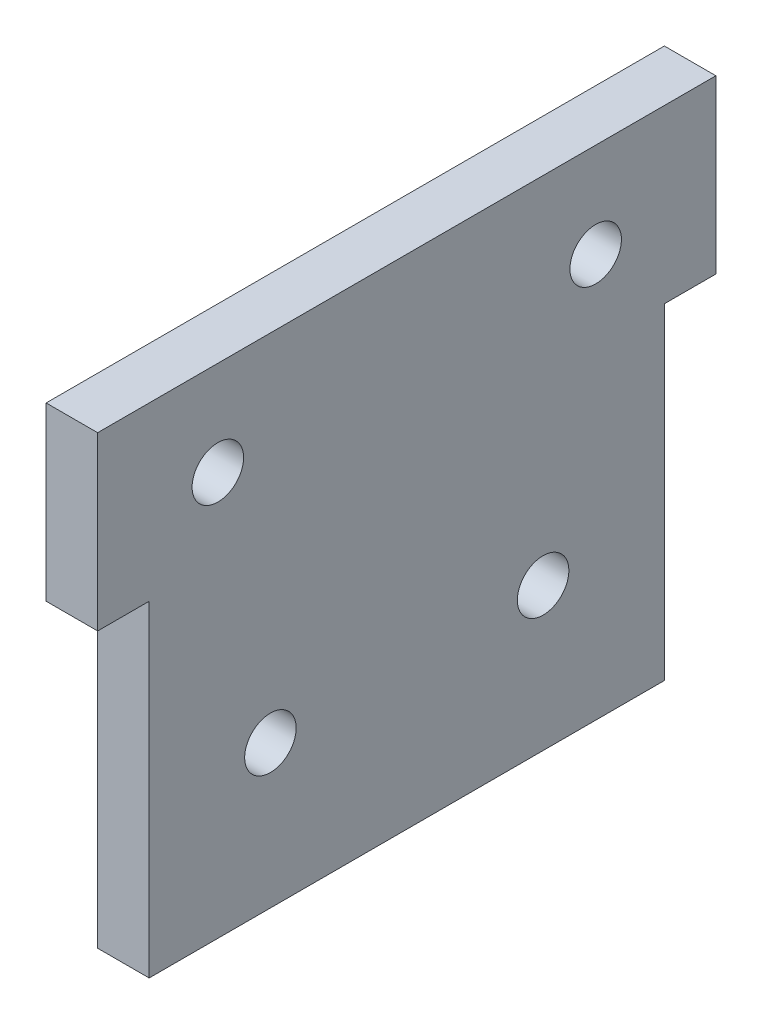
from build123d import *

# Parameters (mm, degrees)
SKETCH1_R           = 1.5
BOSS_EXTRUDE1_DEPTH = 3


with BuildPart() as part:
    # Sketch1 → Boss-Extrude1 (new body)
    with BuildSketch(Plane(origin=(0, 0, 0), x_dir=(0, 0, -1), z_dir=(1, 0, 0))):
        Polygon((15, 3.289322104), (-15, 3.289322104), (-15, 22.289322104), (-18, 22.289322104), (-18, 32.289322104), (-15, 32.289322104), (15, 32.289322104), (18, 32.289322104), (18, 22.289322104), (15, 22.289322104), align=None)
        with Locations((7.94, 11.619322104)):
            Circle(SKETCH1_R, mode=Mode.SUBTRACT)
        with Locations(Location((-7.94, 11.619322104, 0), (0, 0, 180))):
            Circle(SKETCH1_R, mode=Mode.SUBTRACT)
        with Locations((11, 26.789322104)):
            Circle(SKETCH1_R, mode=Mode.SUBTRACT)
        with Locations(Location((-11, 26.789322104, 0), (0, 0, 180))):
            Circle(SKETCH1_R, mode=Mode.SUBTRACT)
    extrude(amount=BOSS_EXTRUDE1_DEPTH)


solid = part.part
